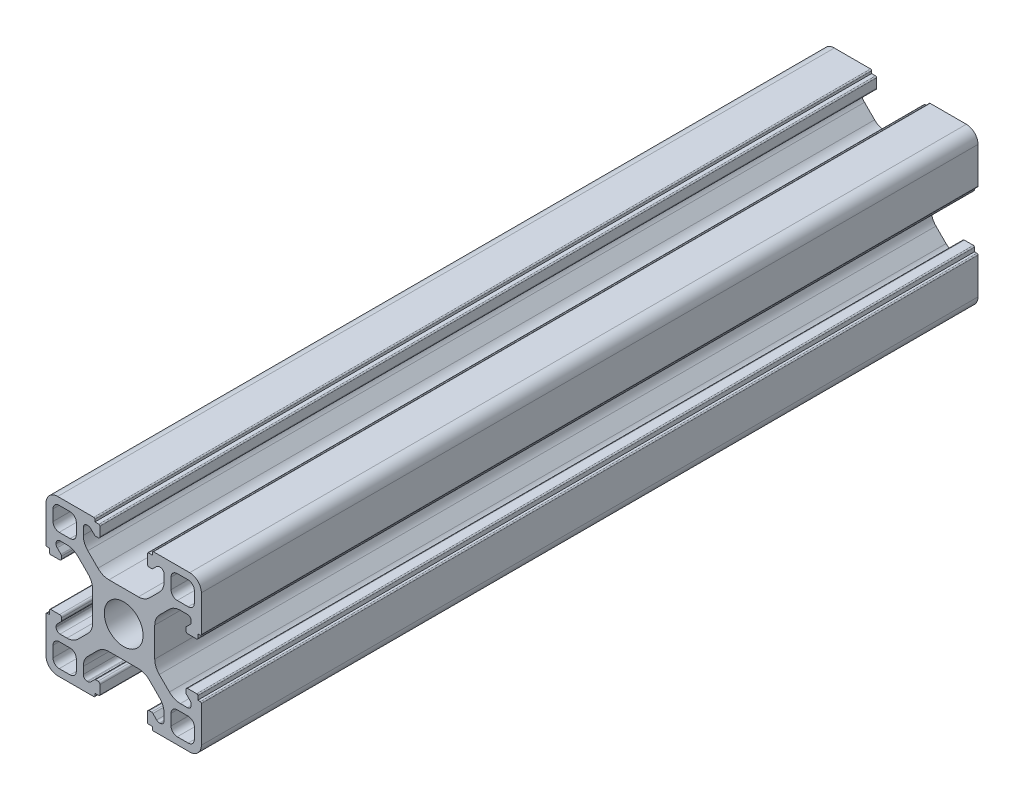
from build123d import *

# Parameters (mm, degrees)
EXTRUDE_1_DEPTH = 100


with BuildPart() as part:
    # Эскиз1 → Бобышка-Вытянуть1 (new body)
    with BuildSketch(Plane.XY):
        with BuildLine():
            Line((-0.000296307, 4.55357973), (1.898484362, 4.55357973))
            ThreePointArc((1.898484362, 4.55357973), (2.663851227, 4.705820665), (3.312697924, 5.139366167))
            Line((3.312697924, 5.139366167), (4.613917255, 6.440585498))
            ThreePointArc((4.613917255, 6.440585498), (5.047462758, 7.089432196), (5.199703693, 7.854799061))
            Line((5.199703693, 7.854799061), (5.199703693, 8.75357973))
            ThreePointArc((5.199703693, 8.75357973), (5.053257083, 9.10713312), (4.699703693, 9.25357973))
            Line((4.699703693, 9.25357973), (4.596810474, 9.25357973))
            ThreePointArc((4.596810474, 9.25357973), (4.405468758, 9.215519496), (4.243257083, 9.10713312))
            Line((4.243257083, 9.10713312), (3.762926997, 8.626803034))
            ThreePointArc((3.762926997, 8.626803034), (3.68182116, 8.572609847), (3.586150302, 8.55357973))
            Line((3.586150302, 8.55357973), (3.299703693, 8.55357973))
            ThreePointArc((3.299703693, 8.55357973), (3.122926997, 8.626803034), (3.049703693, 8.80357973))
            Line((3.049703693, 8.80357973), (3.049703693, 9.95265055))
            ThreePointArc((3.049703693, 9.95265055), (3.093637676, 10.058716567), (3.199703693, 10.10265055))
            Line((3.199703693, 10.10265055), (3.699703693, 10.10265055))
            Line((3.699703693, 10.10265055), (3.699703693, 10.40357973))
            ThreePointArc((3.699703693, 10.40357973), (3.743637676, 10.509645747), (3.849703693, 10.55357973))
            Line((3.849703693, 10.55357973), (8.499703693, 10.55357973))
            ThreePointArc((8.499703693, 10.55357973), (9.560363865, 10.114239901), (9.999703693, 9.05357973))
            Line((9.999703693, 9.05357973), (9.999703693, 4.40357973))
            ThreePointArc((9.999703693, 4.40357973), (9.95576971, 4.297513712), (9.849703693, 4.25357973))
            Line((9.849703693, 4.25357973), (9.548774513, 4.25357973))
            Line((9.548774513, 4.25357973), (9.548774513, 3.75357973))
            ThreePointArc((9.548774513, 3.75357973), (9.50484053, 3.647513712), (9.398774513, 3.60357973))
            Line((9.398774513, 3.60357973), (8.249703693, 3.60357973))
            ThreePointArc((8.249703693, 3.60357973), (8.072926997, 3.676803034), (7.999703693, 3.85357973))
            Line((7.999703693, 3.85357973), (7.999703693, 4.140026339))
            ThreePointArc((7.999703693, 4.140026339), (8.01873381, 4.235697197), (8.072926997, 4.316803034))
            Line((8.072926997, 4.316803034), (8.553257083, 4.79713312))
            ThreePointArc((8.553257083, 4.79713312), (8.661643459, 4.959344795), (8.699703693, 5.150686511))
            Line((8.699703693, 5.150686511), (8.699703693, 5.25357973))
            ThreePointArc((8.699703693, 5.25357973), (8.553257083, 5.60713312), (8.199703693, 5.75357973))
            Line((8.199703693, 5.75357973), (7.300923024, 5.75357973))
            ThreePointArc((7.300923024, 5.75357973), (6.535556159, 5.601338795), (5.886709461, 5.167793292))
            Line((5.886709461, 5.167793292), (4.58549013, 3.866573961))
            ThreePointArc((4.58549013, 3.866573961), (4.151944628, 3.217727263), (3.999703693, 2.452360399))
            Line((3.999703693, 2.452360399), (3.999703693, 0.55357973))
            Line((3.999703693, 0.55357973), (3.999703693, -1.345200939))
            ThreePointArc((3.999703693, -1.345200939), (4.151944628, -2.110567804), (4.58549013, -2.759414502))
            Line((4.58549013, -2.759414502), (5.886709461, -4.060633833))
            ThreePointArc((5.886709461, -4.060633833), (6.535556159, -4.494179335), (7.300923024, -4.64642027))
            Line((7.300923024, -4.64642027), (8.199703693, -4.64642027))
            ThreePointArc((8.199703693, -4.64642027), (8.553257083, -4.499973661), (8.699703693, -4.14642027))
            Line((8.699703693, -4.14642027), (8.699703693, -4.043527052))
            ThreePointArc((8.699703693, -4.043527052), (8.661643459, -3.852185335), (8.553257083, -3.689973661))
            Line((8.553257083, -3.689973661), (8.072926997, -3.209643575))
            ThreePointArc((8.072926997, -3.209643575), (8.01873381, -3.128537738), (7.999703693, -3.03286688))
            Line((7.999703693, -3.03286688), (7.999703693, -2.74642027))
            ThreePointArc((7.999703693, -2.74642027), (8.072926997, -2.569643575), (8.249703693, -2.49642027))
            Line((8.249703693, -2.49642027), (9.398774513, -2.49642027))
            ThreePointArc((9.398774513, -2.49642027), (9.50484053, -2.540354253), (9.548774513, -2.64642027))
            Line((9.548774513, -2.64642027), (9.548774513, -3.14642027))
            Line((9.548774513, -3.14642027), (9.849703693, -3.14642027))
            ThreePointArc((9.849703693, -3.14642027), (9.95576971, -3.190354253), (9.999703693, -3.29642027))
            Line((9.999703693, -3.29642027), (9.999703693, -7.94642027))
            ThreePointArc((9.999703693, -7.94642027), (9.560363865, -9.007080442), (8.499703693, -9.44642027))
            Line((8.499703693, -9.44642027), (3.849703693, -9.44642027))
            ThreePointArc((3.849703693, -9.44642027), (3.743637676, -9.402486288), (3.699703693, -9.29642027))
            Line((3.699703693, -9.29642027), (3.699703693, -8.995491091))
            Line((3.699703693, -8.995491091), (3.199703693, -8.995491091))
            ThreePointArc((3.199703693, -8.995491091), (3.093637676, -8.951557108), (3.049703693, -8.845491091))
            Line((3.049703693, -8.845491091), (3.049703693, -7.69642027))
            ThreePointArc((3.049703693, -7.69642027), (3.122926997, -7.519643575), (3.299703693, -7.44642027))
            Line((3.299703693, -7.44642027), (3.586150302, -7.44642027))
            ThreePointArc((3.586150302, -7.44642027), (3.68182116, -7.465450387), (3.762926997, -7.519643575))
            Line((3.762926997, -7.519643575), (4.243257083, -7.999973661))
            ThreePointArc((4.243257083, -7.999973661), (4.405468758, -8.108360037), (4.596810474, -8.14642027))
            Line((4.596810474, -8.14642027), (4.699703693, -8.14642027))
            ThreePointArc((4.699703693, -8.14642027), (5.053257083, -7.999973661), (5.199703693, -7.64642027))
            Line((5.199703693, -7.64642027), (5.199703693, -6.747639601))
            ThreePointArc((5.199703693, -6.747639601), (5.047462758, -5.982272737), (4.613917255, -5.333426039))
            Line((4.613917255, -5.333426039), (3.312697924, -4.032206708))
            ThreePointArc((3.312697924, -4.032206708), (2.663851227, -3.598661205), (1.898484362, -3.44642027))
            Line((1.898484362, -3.44642027), (-0.000296307, -3.44642027))
            Line((-0.000296307, -3.44642027), (-1.899076976, -3.44642027))
            ThreePointArc((-1.899076976, -3.44642027), (-2.664443841, -3.598661205), (-3.313290539, -4.032206708))
            Line((-3.313290539, -4.032206708), (-4.61450987, -5.333426039))
            ThreePointArc((-4.61450987, -5.333426039), (-5.048055372, -5.982272737), (-5.200296307, -6.747639601))
            Line((-5.200296307, -6.747639601), (-5.200296307, -7.64642027))
            ThreePointArc((-5.200296307, -7.64642027), (-5.053849698, -7.999973661), (-4.700296307, -8.14642027))
            Line((-4.700296307, -8.14642027), (-4.597403088, -8.14642027))
            ThreePointArc((-4.597403088, -8.14642027), (-4.406061372, -8.108360037), (-4.243849698, -7.999973661))
            Line((-4.243849698, -7.999973661), (-3.763519612, -7.519643575))
            ThreePointArc((-3.763519612, -7.519643575), (-3.682413775, -7.465450387), (-3.586742917, -7.44642027))
            Line((-3.586742917, -7.44642027), (-3.300296307, -7.44642027))
            ThreePointArc((-3.300296307, -7.44642027), (-3.123519612, -7.519643575), (-3.050296307, -7.69642027))
            Line((-3.050296307, -7.69642027), (-3.050296307, -8.845491091))
            ThreePointArc((-3.050296307, -8.845491091), (-3.09423029, -8.951557108), (-3.200296307, -8.995491091))
            Line((-3.200296307, -8.995491091), (-3.700296307, -8.995491091))
            Line((-3.700296307, -8.995491091), (-3.700296307, -9.29642027))
            ThreePointArc((-3.700296307, -9.29642027), (-3.74423029, -9.402486288), (-3.850296307, -9.44642027))
            Line((-3.850296307, -9.44642027), (-8.500296307, -9.44642027))
            ThreePointArc((-8.500296307, -9.44642027), (-9.560956479, -9.007080442), (-10.000296307, -7.94642027))
            Line((-10.000296307, -7.94642027), (-10.000296307, -3.29642027))
            ThreePointArc((-10.000296307, -3.29642027), (-9.956362324, -3.190354253), (-9.850296307, -3.14642027))
            Line((-9.850296307, -3.14642027), (-9.549367128, -3.14642027))
            Line((-9.549367128, -3.14642027), (-9.549367128, -2.64642027))
            ThreePointArc((-9.549367128, -2.64642027), (-9.505433145, -2.540354253), (-9.399367128, -2.49642027))
            Line((-9.399367128, -2.49642027), (-8.250296307, -2.49642027))
            ThreePointArc((-8.250296307, -2.49642027), (-8.073519612, -2.569643575), (-8.000296307, -2.74642027))
            Line((-8.000296307, -2.74642027), (-8.000296307, -3.03286688))
            ThreePointArc((-8.000296307, -3.03286688), (-8.019326424, -3.128537738), (-8.073519612, -3.209643575))
            Line((-8.073519612, -3.209643575), (-8.553849698, -3.689973661))
            ThreePointArc((-8.553849698, -3.689973661), (-8.662236073, -3.852185335), (-8.700296307, -4.043527052))
            Line((-8.700296307, -4.043527052), (-8.700296307, -4.14642027))
            ThreePointArc((-8.700296307, -4.14642027), (-8.553849698, -4.499973661), (-8.200296307, -4.64642027))
            Line((-8.200296307, -4.64642027), (-7.301515638, -4.64642027))
            ThreePointArc((-7.301515638, -4.64642027), (-6.536148773, -4.494179335), (-5.887302076, -4.060633833))
            Line((-5.887302076, -4.060633833), (-4.586082745, -2.759414502))
            ThreePointArc((-4.586082745, -2.759414502), (-4.152537242, -2.110567804), (-4.000296307, -1.345200939))
            Line((-4.000296307, -1.345200939), (-4.000296307, 0.55357973))
            Line((-4.000296307, 0.55357973), (-4.000296307, 2.452360399))
            ThreePointArc((-4.000296307, 2.452360399), (-4.152537242, 3.217727263), (-4.586082745, 3.866573961))
            Line((-4.586082745, 3.866573961), (-5.887302076, 5.167793292))
            ThreePointArc((-5.887302076, 5.167793292), (-6.536148773, 5.601338795), (-7.301515638, 5.75357973))
            Line((-7.301515638, 5.75357973), (-8.200296307, 5.75357973))
            ThreePointArc((-8.200296307, 5.75357973), (-8.553849698, 5.60713312), (-8.700296307, 5.25357973))
            Line((-8.700296307, 5.25357973), (-8.700296307, 5.150686511))
            ThreePointArc((-8.700296307, 5.150686511), (-8.662236073, 4.959344795), (-8.553849698, 4.79713312))
            Line((-8.553849698, 4.79713312), (-8.073519612, 4.316803034))
            ThreePointArc((-8.073519612, 4.316803034), (-8.019326424, 4.235697197), (-8.000296307, 4.140026339))
            Line((-8.000296307, 4.140026339), (-8.000296307, 3.85357973))
            ThreePointArc((-8.000296307, 3.85357973), (-8.073519612, 3.676803034), (-8.250296307, 3.60357973))
            Line((-8.250296307, 3.60357973), (-9.399367128, 3.60357973))
            ThreePointArc((-9.399367128, 3.60357973), (-9.505433145, 3.647513712), (-9.549367128, 3.75357973))
            Line((-9.549367128, 3.75357973), (-9.549367128, 4.25357973))
            Line((-9.549367128, 4.25357973), (-9.850296307, 4.25357973))
            ThreePointArc((-9.850296307, 4.25357973), (-9.956362324, 4.297513712), (-10.000296307, 4.40357973))
            Line((-10.000296307, 4.40357973), (-10.000296307, 9.05357973))
            ThreePointArc((-10.000296307, 9.05357973), (-9.560956479, 10.114239901), (-8.500296307, 10.55357973))
            Line((-8.500296307, 10.55357973), (-3.850296307, 10.55357973))
            ThreePointArc((-3.850296307, 10.55357973), (-3.74423029, 10.509645747), (-3.700296307, 10.40357973))
            Line((-3.700296307, 10.40357973), (-3.700296307, 10.10265055))
            Line((-3.700296307, 10.10265055), (-3.200296307, 10.10265055))
            ThreePointArc((-3.200296307, 10.10265055), (-3.09423029, 10.058716567), (-3.050296307, 9.95265055))
            Line((-3.050296307, 9.95265055), (-3.050296307, 8.80357973))
            ThreePointArc((-3.050296307, 8.80357973), (-3.123519612, 8.626803034), (-3.300296307, 8.55357973))
            Line((-3.300296307, 8.55357973), (-3.586742917, 8.55357973))
            ThreePointArc((-3.586742917, 8.55357973), (-3.682413775, 8.572609847), (-3.763519612, 8.626803034))
            Line((-3.763519612, 8.626803034), (-4.243849698, 9.10713312))
            ThreePointArc((-4.243849698, 9.10713312), (-4.406061372, 9.215519496), (-4.597403088, 9.25357973))
            Line((-4.597403088, 9.25357973), (-4.700296307, 9.25357973))
            ThreePointArc((-4.700296307, 9.25357973), (-5.053849698, 9.10713312), (-5.200296307, 8.75357973))
            Line((-5.200296307, 8.75357973), (-5.200296307, 7.854799061))
            ThreePointArc((-5.200296307, 7.854799061), (-5.048055372, 7.089432196), (-4.61450987, 6.440585498))
            Line((-4.61450987, 6.440585498), (-3.313290539, 5.139366167))
            ThreePointArc((-3.313290539, 5.139366167), (-2.664443841, 4.705820665), (-1.899076976, 4.55357973))
            Line((-1.899076976, 4.55357973), (-0.000296307, 4.55357973))
        make_face()
        with BuildLine():
            Line((6.899703693, 6.65357973), (8.299703693, 6.65357973))
            ThreePointArc((8.299703693, 6.65357973), (8.865389118, 6.887894305), (9.099703693, 7.45357973))
            Line((9.099703693, 7.45357973), (9.099703693, 8.85357973))
            ThreePointArc((9.099703693, 8.85357973), (8.865389118, 9.419265155), (8.299703693, 9.65357973))
            Line((8.299703693, 9.65357973), (6.899703693, 9.65357973))
            ThreePointArc((6.899703693, 9.65357973), (6.334018268, 9.419265155), (6.099703693, 8.85357973))
            Line((6.099703693, 8.85357973), (6.099703693, 7.45357973))
            ThreePointArc((6.099703693, 7.45357973), (6.334018268, 6.887894305), (6.899703693, 6.65357973))
        make_face(mode=Mode.SUBTRACT)
        with BuildLine():
            Line((6.099703693, -6.34642027), (6.099703693, -7.74642027))
            ThreePointArc((6.099703693, -7.74642027), (6.334018268, -8.312105695), (6.899703693, -8.54642027))
            Line((6.899703693, -8.54642027), (8.299703693, -8.54642027))
            ThreePointArc((8.299703693, -8.54642027), (8.865389118, -8.312105695), (9.099703693, -7.74642027))
            Line((9.099703693, -7.74642027), (9.099703693, -6.34642027))
            ThreePointArc((9.099703693, -6.34642027), (8.865389118, -5.780734845), (8.299703693, -5.54642027))
            Line((8.299703693, -5.54642027), (6.899703693, -5.54642027))
            ThreePointArc((6.899703693, -5.54642027), (6.334018268, -5.780734845), (6.099703693, -6.34642027))
        make_face(mode=Mode.SUBTRACT)
        with BuildLine():
            Line((-6.900296307, -5.54642027), (-8.300296307, -5.54642027))
            ThreePointArc((-8.300296307, -5.54642027), (-8.865981732, -5.780734845), (-9.100296307, -6.34642027))
            Line((-9.100296307, -6.34642027), (-9.100296307, -7.74642027))
            ThreePointArc((-9.100296307, -7.74642027), (-8.865981732, -8.312105695), (-8.300296307, -8.54642027))
            Line((-8.300296307, -8.54642027), (-6.900296307, -8.54642027))
            ThreePointArc((-6.900296307, -8.54642027), (-6.334610882, -8.312105695), (-6.100296307, -7.74642027))
            Line((-6.100296307, -7.74642027), (-6.100296307, -6.34642027))
            ThreePointArc((-6.100296307, -6.34642027), (-6.334610882, -5.780734845), (-6.900296307, -5.54642027))
        make_face(mode=Mode.SUBTRACT)
        with BuildLine():
            Line((-6.100296307, 7.45357973), (-6.100296307, 8.85357973))
            ThreePointArc((-6.100296307, 8.85357973), (-6.334610882, 9.419265155), (-6.900296307, 9.65357973))
            Line((-6.900296307, 9.65357973), (-8.300296307, 9.65357973))
            ThreePointArc((-8.300296307, 9.65357973), (-8.865981732, 9.419265155), (-9.100296307, 8.85357973))
            Line((-9.100296307, 8.85357973), (-9.100296307, 7.45357973))
            ThreePointArc((-9.100296307, 7.45357973), (-8.865981732, 6.887894305), (-8.300296307, 6.65357973))
            Line((-8.300296307, 6.65357973), (-6.900296307, 6.65357973))
            ThreePointArc((-6.900296307, 6.65357973), (-6.334610882, 6.887894305), (-6.100296307, 7.45357973))
        make_face(mode=Mode.SUBTRACT)
        with BuildLine():
            ThreePointArc((2.499703693, 0.55357973), (1.767470646, 2.321346683), (-0.000296307, 3.05357973))
            ThreePointArc((-0.000296307, 3.05357973), (-1.76806326, 2.321346683), (-2.500296307, 0.55357973))
            ThreePointArc((-2.500296307, 0.55357973), (-1.76806326, -1.214187223), (-0.000296307, -1.94642027))
            ThreePointArc((-0.000296307, -1.94642027), (1.767470646, -1.214187223), (2.499703693, 0.55357973))
        make_face(mode=Mode.SUBTRACT)
    extrude(amount=EXTRUDE_1_DEPTH)


solid = part.part
